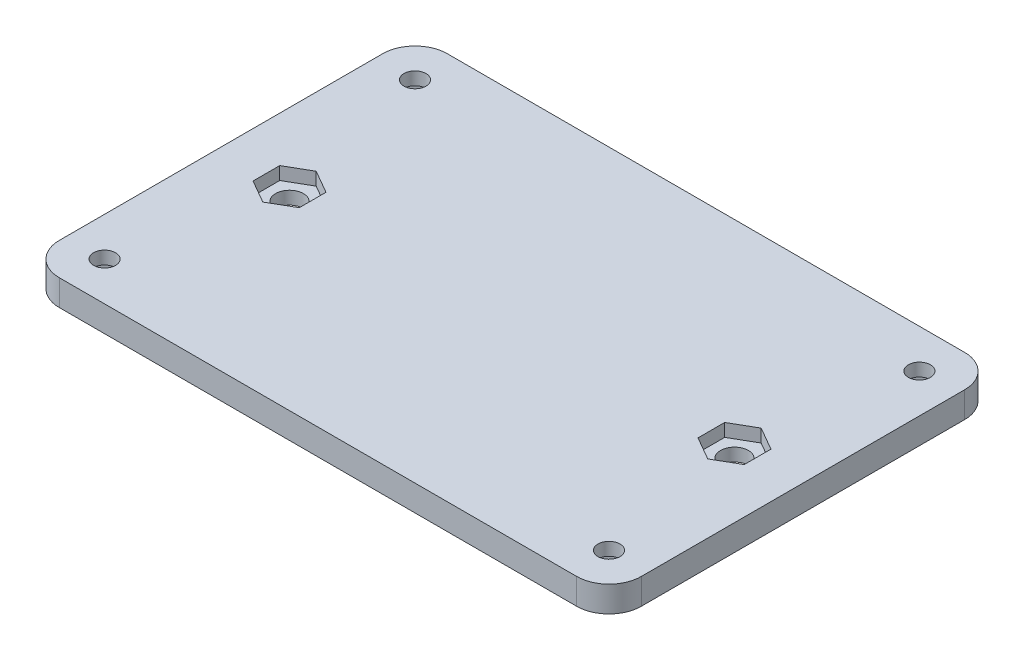
from build123d import *

# Parameters (mm, degrees)
SKETCH1_W           = 90
SKETCH1_H           = 60
BOSS_EXTRUDE1_DEPTH = 4
SKETCH2_R           = 2.15
SKETCH2_R_2         = 1.7
CUT_EXTRUDE1_DEPTH  = 4
CUT_EXTRUDE2_DEPTH  = 2
CUT_EXTRUDE3_DEPTH  = 2
FILLET3_R           = 5


with BuildPart() as part:
    # Sketch1 → Boss-Extrude1 (new body)
    with BuildSketch(Plane(origin=(0, 0, 0), x_dir=(1, 0, 0), z_dir=(0, 1, 0))):
        Rectangle(SKETCH1_W, SKETCH1_H)
    extrude(amount=BOSS_EXTRUDE1_DEPTH)

    # Sketch2 → Cut-Extrude1 (cut)
    with BuildSketch(Plane(origin=(0, 4, 0), x_dir=(1, 0, 0), z_dir=(0, 1, 0))):
        with Locations(Location((-34.3999999, -0.00262532, 0), (0, 0, 270))):
            Circle(SKETCH2_R)
        with Locations(Location((34.400000034, 0.00039051, 0), (0, 0, 270))):
            Circle(SKETCH2_R)
        with Locations(Location((-39, 24, 0), (0, 0, 270))):
            Circle(SKETCH2_R_2)
        with Locations(Location((-39, -24, 0), (0, 0, 270))):
            Circle(SKETCH2_R_2)
        with Locations(Location((39, -24, 0), (0, 0, 270))):
            Circle(SKETCH2_R_2)
        with Locations(Location((39, 24, 0), (0, 0, 270))):
            Circle(SKETCH2_R_2)
    extrude(amount=-CUT_EXTRUDE1_DEPTH, mode=Mode.SUBTRACT)

    # Sketch3 → Cut-Extrude2 (cut)
    with BuildSketch(Plane(origin=(0, 4, 0), x_dir=(1, 0, 0), z_dir=(0, 1, 0))):
        Polygon((-30.8249999, 2.061401893), (-34.3999999, 4.125429105), (-37.9749999, 2.061401893), (-37.9749999, -2.066652532), (-34.3999999, -4.130679744), (-30.8249999, -2.066652532), align=None)
        Polygon((37.975000034, 2.064417722), (34.400000034, 4.128444934), (30.825000034, 2.064417722), (30.825000034, -2.063636703), (34.400000034, -4.127663915), (37.975000034, -2.063636703), align=None)
    extrude(amount=-CUT_EXTRUDE2_DEPTH, mode=Mode.SUBTRACT)

    # Sketch4 → Cut-Extrude3 (cut)
    with BuildSketch(Plane.XZ):
        Polygon((-36.2, 25.616580754), (-39, 27.233161507), (-41.8, 25.616580754), (-41.8, 22.383419246), (-39, 20.766838493), (-36.2, 22.383419246), align=None)
        Polygon((-36.2, -22.383419246), (-39, -20.766838493), (-41.8, -22.383419246), (-41.8, -25.616580754), (-39, -27.233161507), (-36.2, -25.616580754), align=None)
        Polygon((41.8, -22.383419246), (39, -20.766838493), (36.2, -22.383419246), (36.2, -25.616580754), (39, -27.233161507), (41.8, -25.616580754), align=None)
        Polygon((41.8, 25.616580754), (39, 27.233161507), (36.2, 25.616580754), (36.2, 22.383419246), (39, 20.766838493), (41.8, 22.383419246), align=None)
    extrude(amount=-CUT_EXTRUDE3_DEPTH, mode=Mode.SUBTRACT)

    # Fillet3
    fillet3_edges = [part.edges().sort_by_distance(p)[0] for p in [
        (-45, 2, -30),
        (45, 2, -30),
        (45, 2, 30),
        (-45, 2, 30),
    ]]
    fillet(fillet3_edges, radius=FILLET3_R)


solid = part.part
